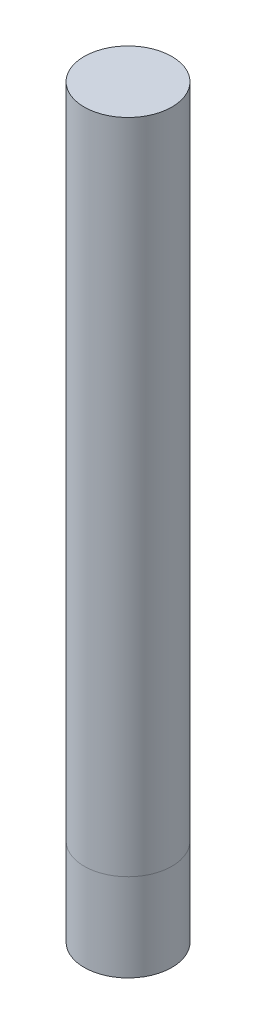
from build123d import *

# Parameters (mm, degrees)
SKICA1_R                 = 4
P_IDAT_VYSUNUT_M1_DEPTH  = 68
SKICA2_R                 = 4
SKICA2_R_2               = 3.999
ODEBRAT_VYSUNUT_M1_DEPTH = 8


with BuildPart() as part:
    # Skica1 → Přidat vysunutím1 (new body)
    with BuildSketch(Plane(origin=(0, 0, 0), x_dir=(1, 0, 0), z_dir=(0, 1, 0))):
        with Locations(Location((0, 0, 0), (0, 0, 270))):
            Circle(SKICA1_R)
    extrude(amount=P_IDAT_VYSUNUT_M1_DEPTH)

    # Skica2 → Odebrat vysunutím1 (cut)
    with BuildSketch(Plane.XZ):
        with Locations(Location((0, 0, 0), (0, 0, 270))):
            Circle(SKICA2_R)
        with Locations(Location((0, 0, 0), (0, 0, 270))):
            Circle(SKICA2_R_2, mode=Mode.SUBTRACT)
    extrude(amount=-ODEBRAT_VYSUNUT_M1_DEPTH, mode=Mode.SUBTRACT)


solid = part.part
